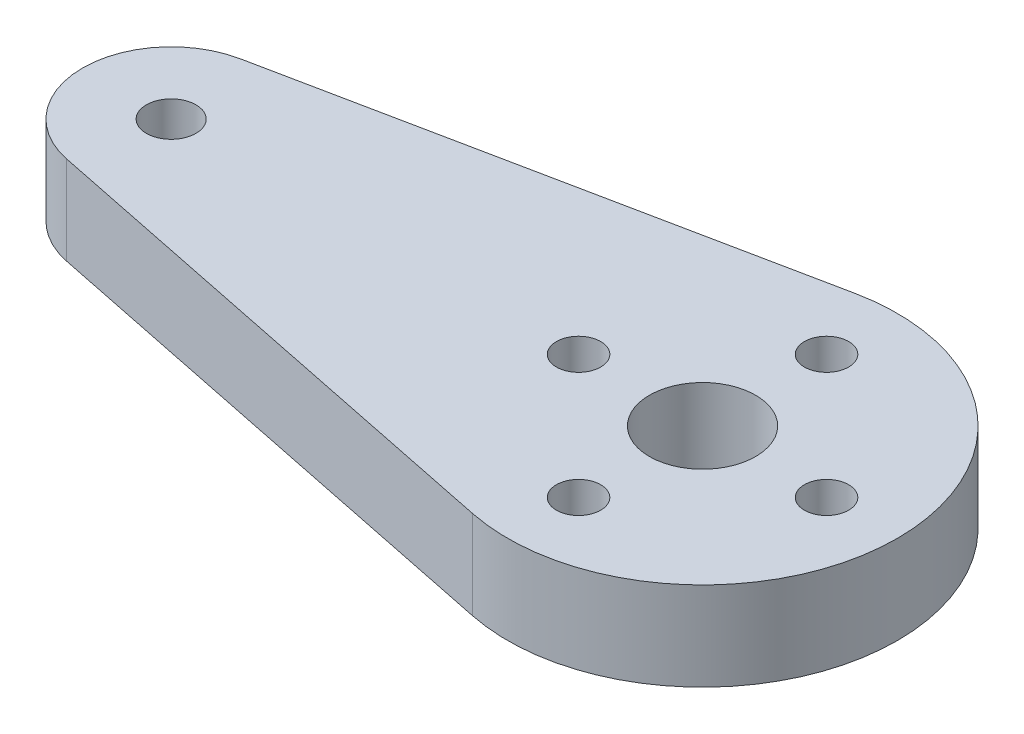
from build123d import *

# Parameters (mm, degrees)
SKETCH1_R           = 3
SKETCH1_R_2         = 1.4
SKETCH1_R_3         = 1.25
BOSS_EXTRUDE1_DEPTH = 5


with BuildPart() as part:
    # Sketch1 → Boss-Extrude1 (new body)
    with BuildSketch(Plane(origin=(0, 0, 0), x_dir=(1, 0, 0), z_dir=(0, 1, 0))):
        with BuildLine():
            Line((-1, 4.898979486), (27.8, 10.777754868))
            ThreePointArc((27.8, 10.777754868), (41, 0), (27.8, -10.777754868))
            Line((27.8, -10.777754868), (-1, -4.898979486))
            ThreePointArc((-1, -4.898979486), (-5, 0), (-1, 4.898979486))
        make_face()
        with Locations((30, 0)):
            Circle(SKETCH1_R, mode=Mode.SUBTRACT)
        Circle(SKETCH1_R_2, mode=Mode.SUBTRACT)
        with Locations((23, 0)):
            Circle(SKETCH1_R_3, mode=Mode.SUBTRACT)
        with Locations((30, 7)):
            Circle(SKETCH1_R_3, mode=Mode.SUBTRACT)
        with Locations((37, 0)):
            Circle(SKETCH1_R_3, mode=Mode.SUBTRACT)
        with Locations((30, -7)):
            Circle(SKETCH1_R_3, mode=Mode.SUBTRACT)
    extrude(amount=BOSS_EXTRUDE1_DEPTH)


solid = part.part
